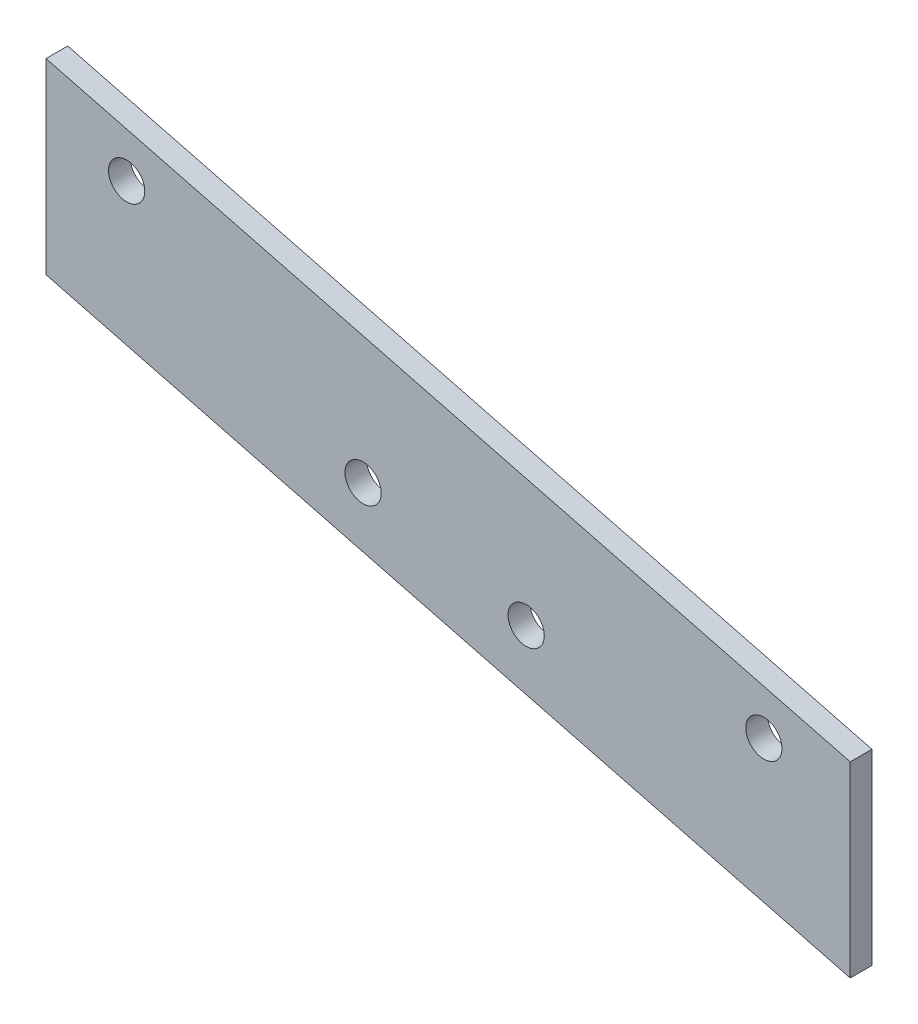
from build123d import *

# Parameters (mm, degrees)
RESSALTO_EXTRUS_O1_DEPTH                = 3
BROCA_DE_ROSQUEAR_PARA_TARRAXA_DE_M61_D = 5


with BuildPart() as part:
    # Esboço1 → Ressalto-extrusão1 (new body)
    with BuildSketch(Plane.XY):
        Polygon((0, 0), (0, 25.814370739), (110.897531805, -2.721177961), (110.897531805, -28.5355487), align=None)
    extrude(amount=RESSALTO_EXTRUS_O1_DEPTH)

    # Broca de rosquear para tarraxa de M61 (through all)
    with Locations(Plane.XY.offset(3)):
        with Locations((11.117838312, 16.758140178), (43.720802317, -2.989400019), (66.208276673, -8.775754406), (98.985562185, -5.851503814)):
            Hole(BROCA_DE_ROSQUEAR_PARA_TARRAXA_DE_M61_D / 2)


solid = part.part
